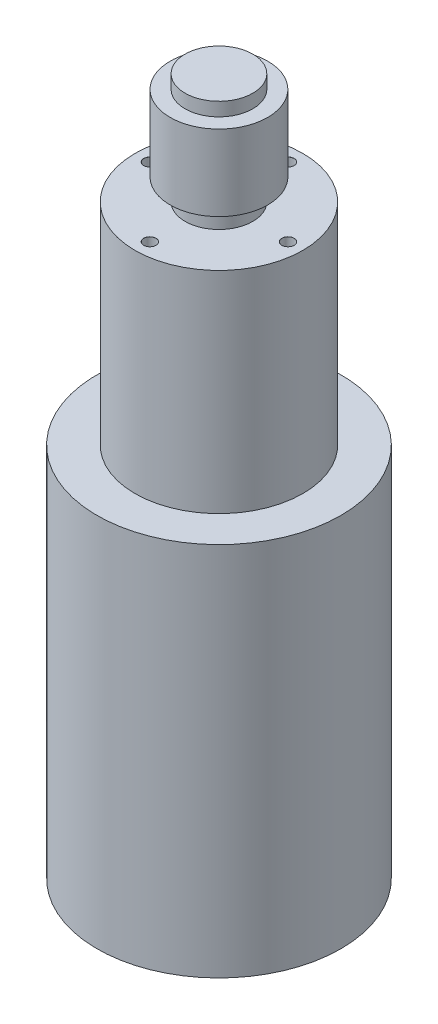
from build123d import *

# Parameters (mm, degrees)
FORO_PER_VITE_M4_1_D           = 4.5
FORO_PER_VITE_M4_1_DEPTH       = 17
FORO_PER_VITE_M4_1_CSINK_D     = 4.55
FORO_PER_VITE_M4_1_CSINK_ANGLE = 90
FORO_PER_VITE_M4_1_TIP         = 1.351936393


with BuildPart() as part:
    # Schizzo2 → Rivoluzione1 (revolve)
    with BuildSketch(Plane.XY):
        Polygon((0, 257.3), (12.5, 257.3), (12.5, 252.3), (18, 252.3), (18, 224.3), (12.5, 224.3), (12.5, 216.3), (31, 216.3), (31, 138.55), (45, 138.55), (45, 0), (0, 0), align=None)
    revolve(axis=Axis((0, -1182.394203663, 0), (0, 1, 0)))

    # Foro per Vite M4-1
    with Locations(Plane(origin=(0, 216.3, 0), x_dir=(1, 0, 0), z_dir=(0, 1, 0))):
        with Locations((0, 25.5), (25.5, 0), (0, -25.5), (-25.5, 0)):
            CounterSinkHole(FORO_PER_VITE_M4_1_D / 2, FORO_PER_VITE_M4_1_CSINK_D / 2, depth=FORO_PER_VITE_M4_1_DEPTH, counter_sink_angle=FORO_PER_VITE_M4_1_CSINK_ANGLE)
            with Locations((0, 0, -(FORO_PER_VITE_M4_1_DEPTH + FORO_PER_VITE_M4_1_TIP / 2))):  # 118° drill point
                Cone(0, FORO_PER_VITE_M4_1_D / 2, FORO_PER_VITE_M4_1_TIP, mode=Mode.SUBTRACT)


solid = part.part
